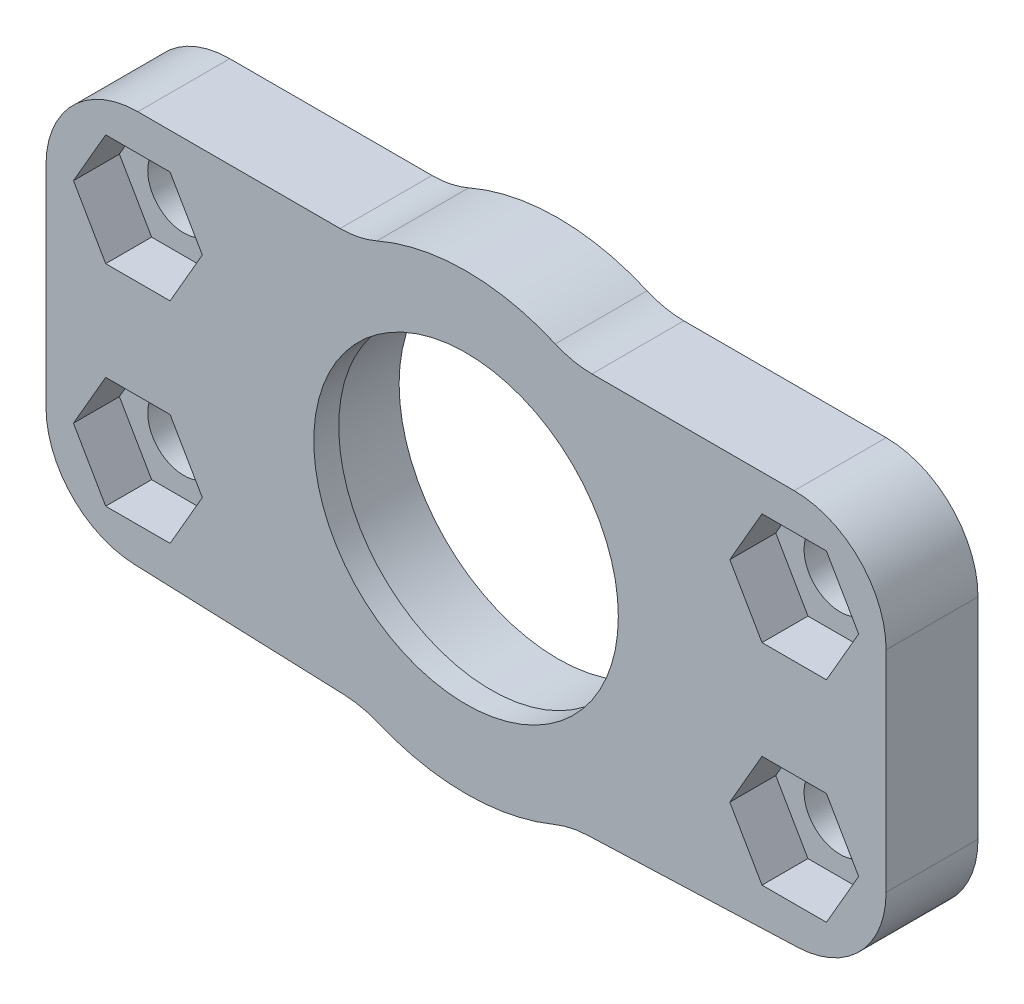
from build123d import *

# Parameters (mm, degrees)
SKETCH_1_R          = 12.1
EXTRUDE_1_DEPTH     = 7
FILLET_3_R          = 7
EXTRUDE_START       = -1.9
SKETCH_7_R          = 12.1
SKETCH_7_R_2        = 11.6
EXTRUDE_2_DEPTH     = 1.9
HOLE_WIZARD_M53_D   = 5.5
HOLE_WIZARD_M54_D   = 5.5
CUT_EXTRUDE_1_DEPTH = 3.5


with BuildPart() as part:
    # Эскиз1 → Бобышка-Вытянуть1 (new body)
    with BuildSketch(Plane.XY):
        with BuildLine():
            Line((-9.282257481, -15.602398743), (-25.265839773, -14.994950265))
            ThreePointArc((-25.265839773, -14.994950265), (-30.042860221, -12.854849204), (-32, -8))
            Line((-32, -8), (-32, 15))
            Line((-32, 15), (-8, 15))
            ThreePointArc((-8, 15), (0, 17), (8, 15))
            Line((8, 15), (32, 15))
            Line((32, 15), (32, -8))
            ThreePointArc((32, -8), (30.042860221, -12.854849204), (25.265839773, -14.994950265))
            Line((25.265839773, -14.994950265), (9.282257481, -15.602398743))
            ThreePointArc((9.282257481, -15.602398743), (7.964469385, -15.770214084), (6.696960066, -16.167891819))
            ThreePointArc((6.696960066, -16.167891819), (0, -17.5), (-6.696960066, -16.167891819))
            ThreePointArc((-6.696960066, -16.167891819), (-7.964469385, -15.770214084), (-9.282257481, -15.602398743))
        make_face()
        Circle(SKETCH_1_R, mode=Mode.SUBTRACT)
    extrude(amount=EXTRUDE_1_DEPTH)

    # Скругление3
    fillet_3_edges = [part.edges().sort_by_distance(p)[0] for p in [
        (-32, 15, 3.5),
        (-8, 15, 3.5),
        (8, 15, 3.5),
        (32, 15, 3.5),
    ]]
    fillet(fillet_3_edges, radius=FILLET_3_R)

    # Эскиз7 → Бобышка-Вытянуть2 (add)
    with BuildSketch(Plane.XY.offset(7).offset(EXTRUDE_START)):
        with Locations(Location((0, 0, 0), (0, 0, 90))):
            Circle(SKETCH_7_R)
        Circle(SKETCH_7_R_2, mode=Mode.SUBTRACT)
    extrude(amount=EXTRUDE_2_DEPTH)

    # Отверстие с зазором M53 (through all)
    with Locations(Plane.XY.offset(7)):
        with Locations((-25, 8), (25, 8)):
            Hole(HOLE_WIZARD_M53_D / 2)

    # Отверстие с зазором M54 (through all)
    with Locations(Plane(origin=(-20.850360387, 7.199740636, 7), x_dir=(-1, 0, 0), z_dir=(0, 0, 1))):
        with Locations((-45.850360387, 15.199740636), (4.149639613, 15.199740636)):
            Hole(HOLE_WIZARD_M54_D / 2)

    # Эскиз18 → Вырез-Вытянуть1 (cut)
    with BuildSketch(Plane(origin=(0, 0, 7), x_dir=(1, 0, 0), z_dir=(0, 0, -1))):
        Polygon((20.092522712, -8), (22.546261356, -12.25), (27.453738644, -12.25), (29.907477288, -8), (27.453738644, -3.75), (22.546261356, -3.75), align=None)
        Polygon((-27.453738644, -3.75), (-29.907477288, -8), (-27.453738644, -12.25), (-22.546261356, -12.25), (-20.092522712, -8), (-22.546261356, -3.75), align=None)
        Polygon((20.092522712, 8), (22.546261356, 12.25), (27.453738644, 12.25), (29.907477288, 8), (27.453738644, 3.75), (22.546261356, 3.75), align=None)
        Polygon((-22.546261356, 12.25), (-20.092522712, 8), (-22.546261356, 3.75), (-27.453738644, 3.75), (-29.907477288, 8), (-27.453738644, 12.25), align=None)
    extrude(amount=CUT_EXTRUDE_1_DEPTH, mode=Mode.SUBTRACT)


solid = part.part
